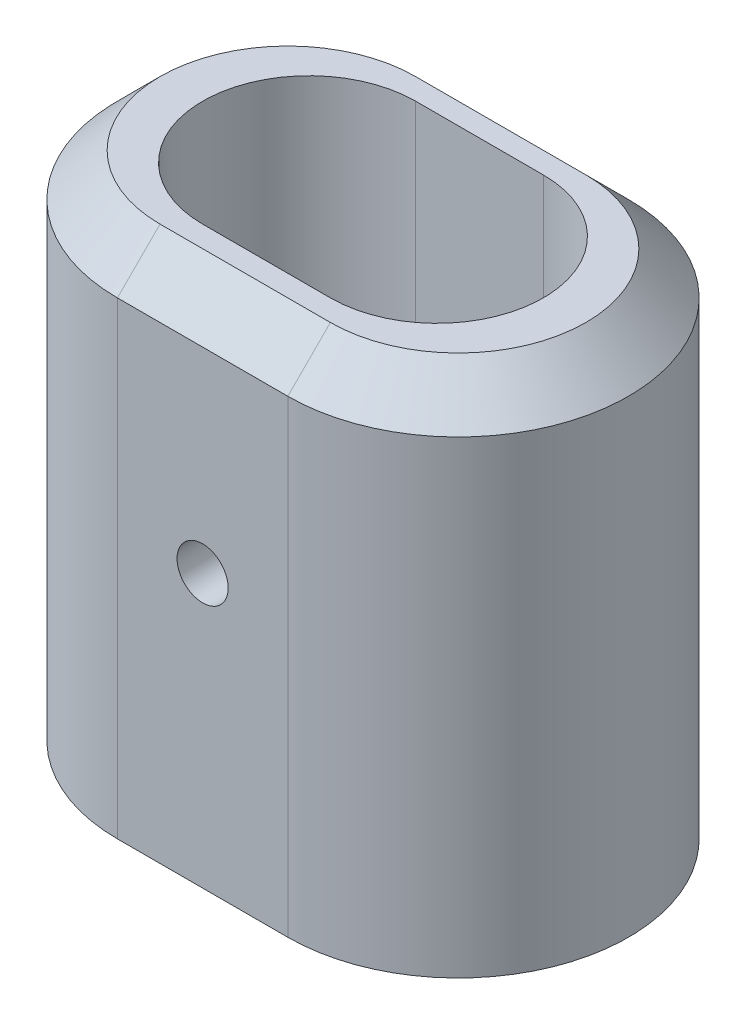
from build123d import *

# Parameters (mm, degrees)
BOSS_EXTRUDE1_DEPTH     = 60
CHAMFER1_SIZE           = 5
CUT_EXTRUDE1_DEPTH      = 75.540257579
CUT_EXTRUDE1_DEPTH_BACK = 75.540257579
SKETCH2_R               = 3


with BuildPart() as part:
    # Sketch1 → Boss-Extrude1 (new body)
    with BuildSketch(Plane(origin=(0, 0, 0), x_dir=(1, 0, 0), z_dir=(0, 1, 0))):
        with BuildLine():
            Line((-10, 20), (10, 20))
            ThreePointArc((10, 20), (30, 0), (10, -20))
            Line((10, -20), (-10, -20))
            ThreePointArc((-10, -20), (-30, 0), (-10, 20))
        make_face()
        with BuildLine():
            Line((-7.5, 12.5), (7.5, 12.5))
            ThreePointArc((7.5, 12.5), (20, 0), (7.5, -12.5))
            Line((7.5, -12.5), (-7.5, -12.5))
            ThreePointArc((-7.5, -12.5), (-20, 0), (-7.5, 12.5))
        make_face(mode=Mode.SUBTRACT)
    extrude(amount=BOSS_EXTRUDE1_DEPTH)

    # Chamfer1
    chamfer1_edges = [part.edges().sort_by_distance(p)[0] for p in [
        (-30, 60, 0),
        (0, 60, 20),
        (30, 60, 0),
        (0, 60, -20),
    ]]
    chamfer(chamfer1_edges, length=CHAMFER1_SIZE)

    # Sketch2 → Cut-Extrude1 (cut, two sides: drawn at the far end of the back side and taken through both)
    with BuildSketch(Plane(origin=(0, 0, 12.5), x_dir=(-1, 0, 0), z_dir=(0, 0, -1)).offset(-CUT_EXTRUDE1_DEPTH_BACK)):
        with Locations((0, 32)):
            Circle(SKETCH2_R)
    extrude(amount=CUT_EXTRUDE1_DEPTH + CUT_EXTRUDE1_DEPTH_BACK, mode=Mode.SUBTRACT)


solid = part.part
